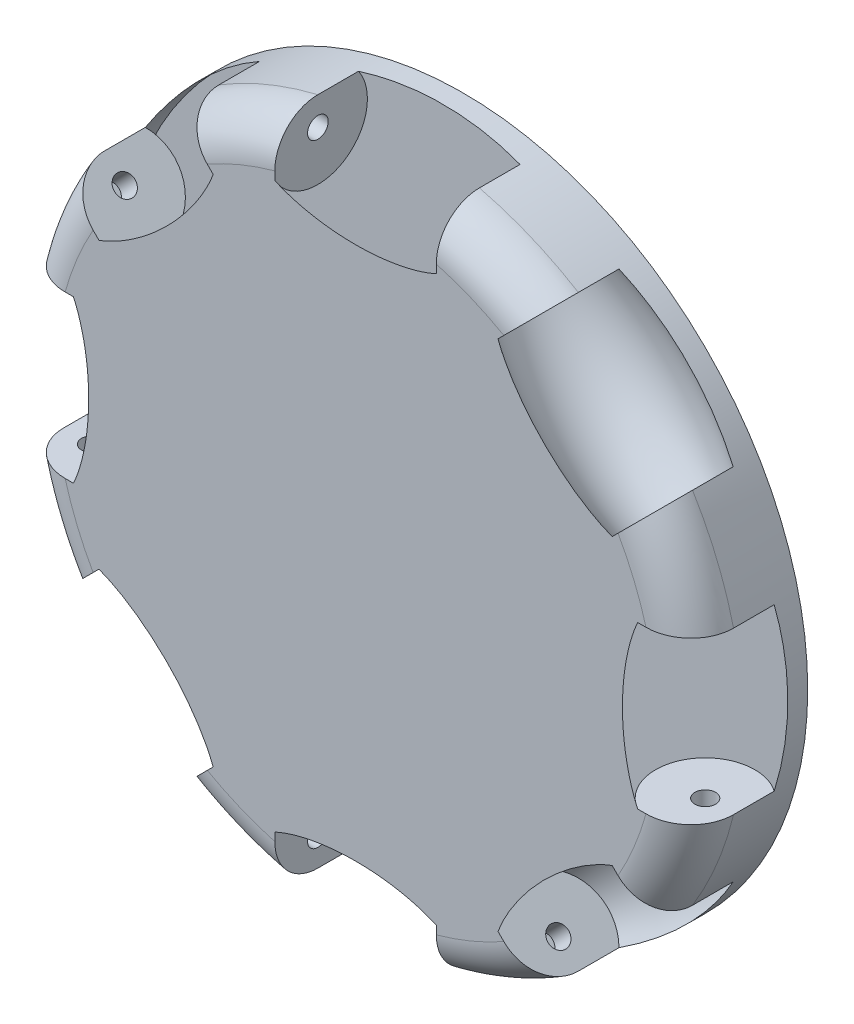
from build123d import *

# Parameters (mm, degrees)
SKETCH1_R           = 25.4
BOSS_EXTRUDE1_DEPTH = 7.9375
FILLET1_R           = 3.175
SKETCH6_R           = 0.762
CUT_EXTRUDE2_DEPTH  = 7.62
CIRPATTERN1_COUNT   = 8


with BuildPart() as part:
    # Sketch1 → Boss-Extrude1 (new body)
    with BuildSketch(Plane.XY):
        Circle(SKETCH1_R)
    extrude(amount=BOSS_EXTRUDE1_DEPTH)

    # Fillet1
    fillet1_edges = [part.edges().sort_by_distance(p)[0] for p in [
        (-25.4, 0, 7.9375),
    ]]
    fillet(fillet1_edges, radius=FILLET1_R)

    # Sketch5 → Cut-Revolve5 (revolve, cut)
    with BuildSketch(Plane.XY.offset(4.7625)):
        with BuildLine():
            Line((-5.953125, 26.25760992), (-5.953125, 22.606))
            Line((-5.953125, 22.606), (5.953125, 22.606))
            Line((5.953125, 22.606), (5.953125, 26.25760992))
            ThreePointArc((5.953125, 26.25760992), (0, 26.924), (-5.953125, 26.25760992))
        make_face()
    cut_revolve5 = revolve(axis=Axis((-5.953125, 22.606, 4.7625), (1, 0, 0)), mode=Mode.SUBTRACT)

    # Sketch6 → Cut-Extrude2 (cut, symmetric)
    with BuildSketch(Plane(origin=(0, 0, 0), x_dir=(0, 0, -1), z_dir=(1, 0, 0))):
        with Locations((-4.7625, 22.606)):
            Circle(SKETCH6_R)
    cut_extrude2 = extrude(amount=CUT_EXTRUDE2_DEPTH, both=True, mode=Mode.SUBTRACT)

    # CirPattern1: Cut-Revolve5, Cut-Extrude2 ×8 about axis
    cirpattern1_axis = Axis((0, 0, 0), (0, 0, 1))
    add([cut_revolve5.rotate(cirpattern1_axis, i * 360 / CIRPATTERN1_COUNT) for i in range(1, CIRPATTERN1_COUNT)], mode=Mode.SUBTRACT)
    add([cut_extrude2.rotate(cirpattern1_axis, i * 360 / CIRPATTERN1_COUNT) for i in range(1, CIRPATTERN1_COUNT)], mode=Mode.SUBTRACT)


solid = part.part
